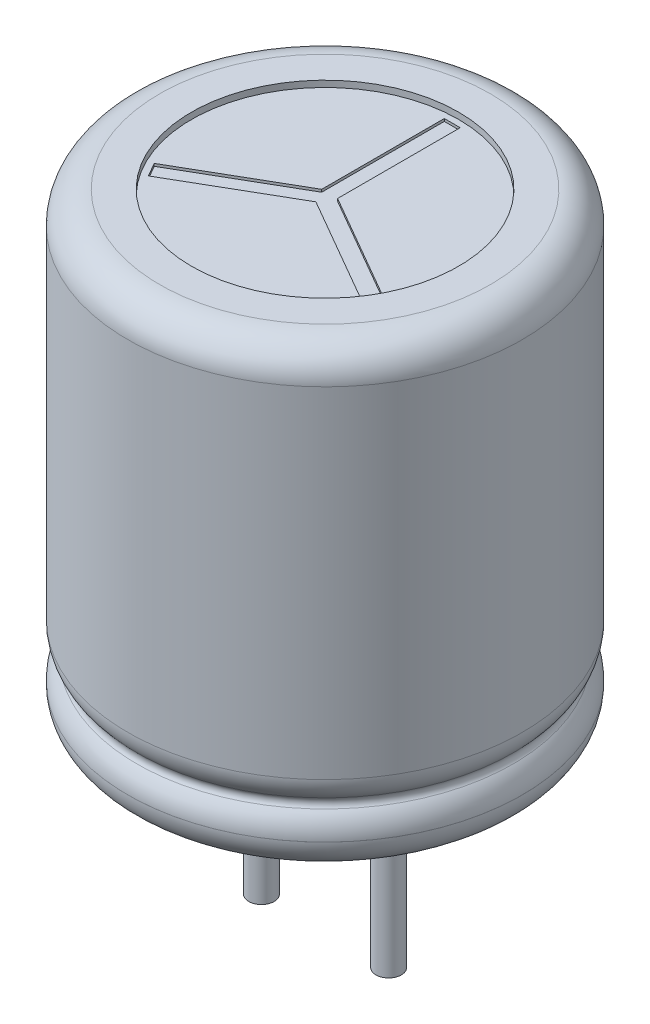
from build123d import *

# Parameters (mm, degrees)
SKETCH4_R             = 0.5
SKETCH3_R             = 0.2
BOSS_EXTRUDE1_DEPTH   = 3
BOSS_EXTRUDE1_2_DEPTH = 3
CUT_EXTRUDE2_DEPTH    = 0.04


with BuildPart() as part:
    # Sketch1 → Revolve1 (revolve)
    with BuildSketch(Plane.XY, mode=Mode.PRIVATE) as revolve1_sk:
        with BuildLine():
            Line((-3, 0.4), (-3, 6.6))
            ThreePointArc((-3, 6.6), (-2.882842712, 6.882842712), (-2.6, 7))
            Line((-2.6, 7), (0, 7))
            Line((0, 7), (0, 0))
            Line((0, 0), (-2.6, 0))
            ThreePointArc((-2.6, 0), (-2.882842712, 0.117157288), (-3, 0.4))
        make_face()
    revolve(revolve1_sk.sketch.rotate(Axis((0, 0, 0), (0, 1, 0)), 270), axis=Axis((0, 0, 0), (0, 1, 0)))

    # Sketch4 → Cut-Revolve1 (revolve, cut)
    with BuildSketch(Plane.XY, mode=Mode.PRIVATE) as cut_revolve1_sk:
        with Locations((-3.4, 0.906567663)):
            Circle(SKETCH4_R)
    revolve(cut_revolve1_sk.sketch.rotate(Axis((0, 0, 0), (0, 1, 0)), 270), axis=Axis((0, 0, 0), (0, 1, 0)), mode=Mode.SUBTRACT)

    # Sketch5 → Cut-Extrude2 (cut)
    with BuildSketch(Plane(origin=(0, 7, 0), x_dir=(1, 0, 0), z_dir=(0, 1, 0))):
        Polygon((-1.794550808, -0.891746825), (-1.669550808, -1.108253175), (0, -0.144337567), (1.669550808, -1.108253175), (1.794550808, -0.891746825), (0.125, 0.072168784), (0.125, 2), (-0.125, 2), (-0.125, 0.072168784), align=None)
    extrude(amount=-CUT_EXTRUDE2_DEPTH, mode=Mode.SUBTRACT)


with BuildPart() as body_2:
    # Sketch2 → Revolve3 (revolve)
    with BuildSketch(Plane.XY, mode=Mode.PRIVATE) as revolve3_sk:
        with BuildLine():
            Line((-2.882536034, 0.683149059), (-3, 1.251681298))
            Line((-3, 1.251681298), (-3, 6.6))
            ThreePointArc((-3, 6.6), (-2.882842712, 6.882842712), (-2.6, 7))
            Line((-2.6, 7), (-2.1, 7))
            Line((-2.1, 7), (-2.1, 7.1))
            Line((-2.1, 7.1), (-2.6, 7.1))
            ThreePointArc((-2.6, 7.1), (-2.953553391, 6.953553391), (-3.1, 6.6))
            Line((-3.1, 6.6), (-3.1, 1.251681298))
            ThreePointArc((-3.1, 1.251681298), (-3.062914799, 1.062710696), (-2.957160446, 0.901772144))
            ThreePointArc((-2.957160446, 0.901772144), (-2.926327941, 0.826242817), (-2.957160446, 0.750713489))
            ThreePointArc((-2.957160446, 0.750713489), (-3.062914799, 0.589774938), (-3.1, 0.4))
            ThreePointArc((-3.1, 0.4), (-2.953553391, 0.046446609), (-2.6, -0.1))
            Line((-2.6, -0.1), (-2.6, 0))
            ThreePointArc((-2.6, 0), (-2.9696347, 0.247126889), (-2.882536034, 0.683149059))
        make_face()
    revolve(revolve3_sk.sketch.rotate(Axis((0, 0, 0), (0, 1, 0)), 270), axis=Axis((0, 0, 0), (0, 1, 0)))


with BuildPart() as body_3:
    # Sketch3 → Boss-Extrude1 (new body)
    with BuildSketch(Plane.XZ):
        with Locations(Location((-1, 0, 0), (0, 0, 270))):
            Circle(SKETCH3_R)
    extrude(amount=BOSS_EXTRUDE1_DEPTH)


with BuildPart() as body_4:
    # Sketch3 → Boss-Extrude1 2 (new body)
    with BuildSketch(Plane.XZ):
        with Locations(Location((1, 0, 0), (0, 0, 90))):
            Circle(SKETCH3_R)
    extrude(amount=BOSS_EXTRUDE1_2_DEPTH)


solid = Compound([part.part, body_2.part, body_3.part, body_4.part])
